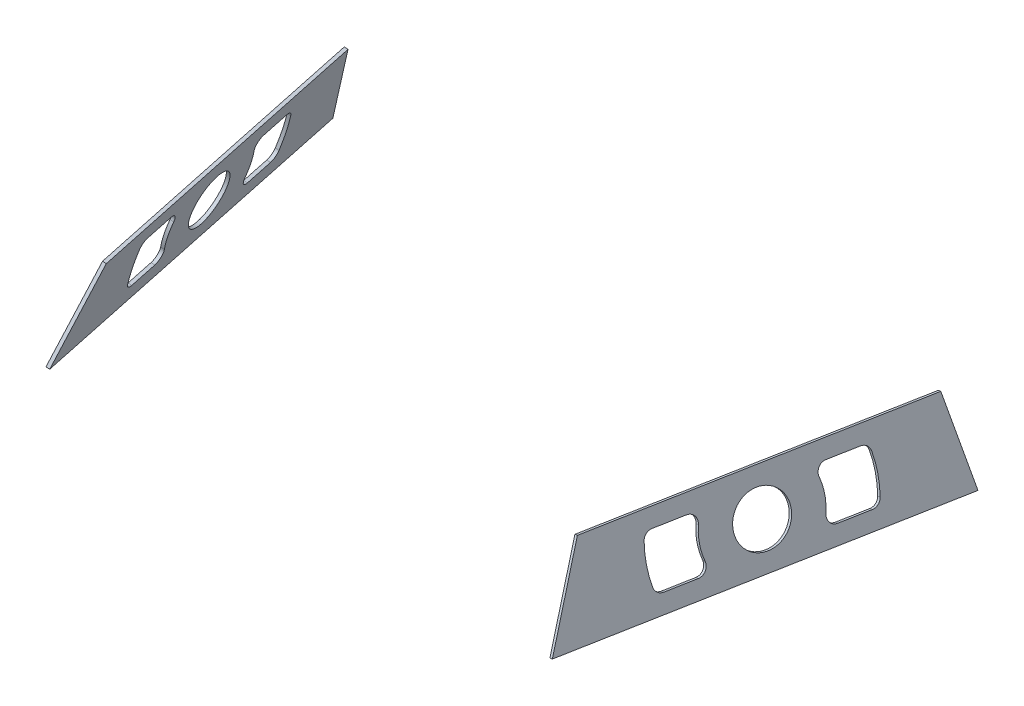
from build123d import *

# Parameters (mm, degrees)
BOSS_EXTRUDE1_START     = 12.7
BOSS_EXTRUDE1_DEPTH     = 2
CUT_EXTRUDE4_DEPTH      = 1797.04556265
CUT_EXTRUDE4_DEPTH_BACK = 1797.04556265
SKETCH3_R               = 15
CUT_EXTRUDE5_DEPTH      = 1796.95506988
CUT_EXTRUDE5_DEPTH_BACK = 1796.95506988


with BuildPart() as part:
    # Sketch1 → Boss-Extrude1 (new body)
    with BuildSketch(Plane(origin=(-657.646924254, 201.024900686, 134.809319163), x_dir=(0.18505627699526195, -0.05267382726489745, 0.9813152614047744), z_dir=(-0.9384580915226618, 0.28686128937701555, 0.19237206427285553)).offset(BOSS_EXTRUDE1_START)):
        Polygon((1392.544897132, 794.160740411), (1385.506771818, 743.820944023), (1606.078262607, 753.087712192), (1580.871537579, 802.072820575), align=None)
    extrude(amount=BOSS_EXTRUDE1_DEPTH)

    # Sketch3 → Cut-Extrude4 (cut, two sides: drawn at the far end of the back side and taken through both)
    with BuildSketch(Plane(origin=(-657.646924254, 201.024900686, 134.809319163), x_dir=(0.18505627699526195, -0.05267382726489745, 0.9813152614047744), z_dir=(-0.9384580915226618, 0.28686128937701555, 0.19237206427285553)).offset(-CUT_EXTRUDE4_DEPTH_BACK)):
        with Locations(Location((1491.250367284, 773.2855543, 0), (0, 0, 89.786696616))):
            Circle(SKETCH3_R)
    extrude(amount=CUT_EXTRUDE4_DEPTH + CUT_EXTRUDE4_DEPTH_BACK, mode=Mode.SUBTRACT)

    # Sketch4 → Cut-Extrude5 (cut, two sides: drawn at the far end of the back side and taken through both)
    with BuildSketch(Plane(origin=(-671.4422582, 205.24176164, 137.637188508), x_dir=(0.18625871511916806, -0.04872436407690483, 0.9812918156121848), z_dir=(-0.9384580915226616, 0.28686128937701677, 0.1923720642728549)).offset(-CUT_EXTRUDE5_DEPTH_BACK)):
        with BuildLine():
            Line((1457.746239108, 780.743585607), (1439.817906985, 780.064506584))
            ThreePointArc((1439.817906985, 780.064506584), (1436.665960559, 778.787820254), (1435.059611388, 775.790431957))
            ThreePointArc((1435.059611388, 775.790431957), (1434.473170135, 764.851305337), (1435.885435701, 753.987884581))
            ThreePointArc((1435.885435701, 753.987884581), (1437.713923604, 751.120599062), (1440.953415416, 750.086003943))
            Line((1440.953415416, 750.086003943), (1458.881747539, 750.765082966))
            ThreePointArc((1458.881747539, 750.765082966), (1462.783354332, 752.88662978), (1463.457520038, 757.276276356))
            ThreePointArc((1463.457520038, 757.276276356), (1461.953464223, 765.892188066), (1462.8014485, 774.597188993))
            ThreePointArc((1462.8014485, 774.597188993), (1461.797153878, 778.923259817), (1457.746239108, 780.743585607))
        make_face()
        with BuildLine():
            Line((1529.978603296, 783.479561433), (1547.906935419, 784.158640456))
            ThreePointArc((1547.906935419, 784.158640456), (1551.146427231, 783.124045336), (1552.974915134, 780.256759817))
            ThreePointArc((1552.974915134, 780.256759817), (1554.3871807, 769.393339061), (1553.800739448, 758.454212442))
            ThreePointArc((1553.800739448, 758.454212442), (1552.194390277, 755.456824145), (1549.04244385, 754.180137815))
            Line((1549.04244385, 754.180137815), (1531.114111727, 753.501058792))
            ThreePointArc((1531.114111727, 753.501058792), (1527.063196957, 755.321384582), (1526.058902335, 759.647455405))
            ThreePointArc((1526.058902335, 759.647455405), (1526.906886612, 768.352456333), (1525.402830797, 776.968368042))
            ThreePointArc((1525.402830797, 776.968368042), (1526.076996503, 781.358014618), (1529.978603296, 783.479561433))
        make_face()
    extrude(amount=CUT_EXTRUDE5_DEPTH + CUT_EXTRUDE5_DEPTH_BACK, mode=Mode.SUBTRACT)


with BuildPart() as body_2:
    # Mirror2: mirrored copy
    add(part.part.mirror(Plane(origin=(0, 0, 0), x_dir=(0, 0, 1), z_dir=(1, 0, 0))))


solid = Compound([part.part, body_2.part])
